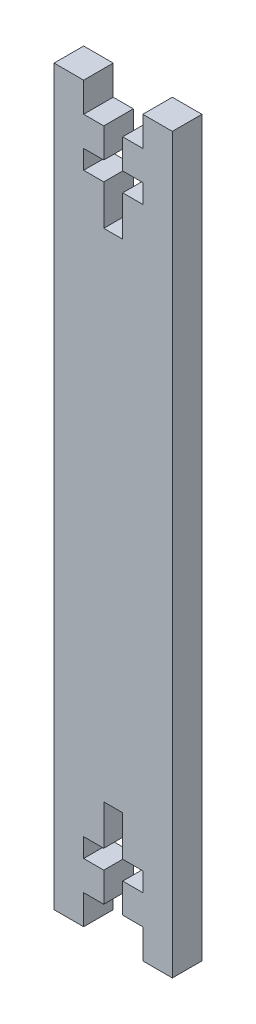
from build123d import *

# Parameters (mm, degrees)
BOSS_EXTRUDE1_DEPTH = 6.35


with BuildPart() as part:
    # Sketch1 → Boss-Extrude1 (new body)
    with BuildSketch(Plane.XY):
        Polygon((6.35, 78.74), (12.7, 78.74), (12.7, -78.74), (6.35, -78.74), (6.35, -72.39), (2.032, -72.39), (2.032, -66.04), (6.35, -66.04), (6.35, -61.976), (2.032, -61.976), (2.032, -53.34), (-2.032, -53.34), (-2.032, -61.976), (-6.35, -61.976), (-6.35, -66.04), (-2.032, -66.04), (-2.032, -72.39), (-6.35, -72.39), (-6.35, -78.74), (-12.7, -78.74), (-12.7, 78.74), (-6.35, 78.74), (-6.35, 72.39), (-2.032, 72.39), (-2.032, 66.04), (-6.35, 66.04), (-6.35, 61.976), (-2.032, 61.976), (-2.032, 53.34), (2.032, 53.34), (2.032, 61.976), (6.35, 61.976), (6.35, 66.04), (2.032, 66.04), (2.032, 72.39), (6.35, 72.39), align=None)
    extrude(amount=BOSS_EXTRUDE1_DEPTH)


solid = part.part
